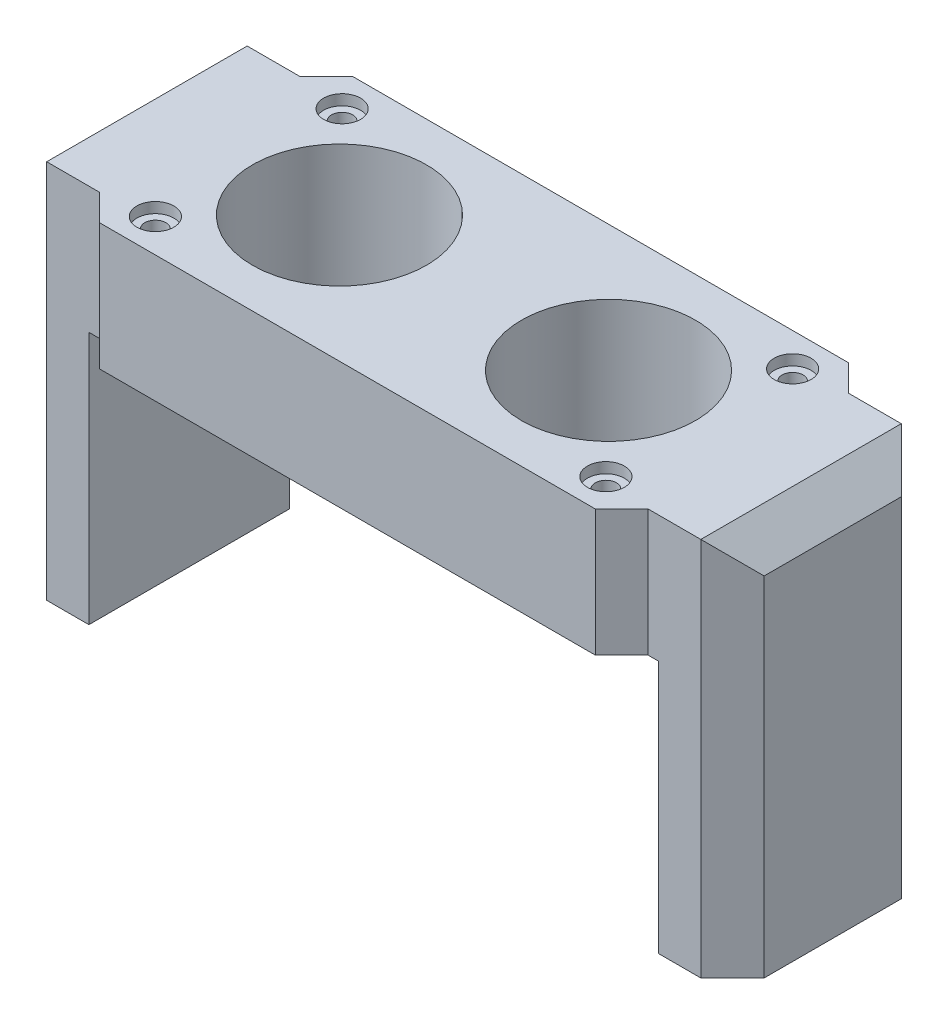
from build123d import *

# Parameters (mm, degrees)
SKETCH1_W                = 52
SKETCH1_H                = 24
SKETCH1_R                = 8.25
BOSS_EXTRUDE1_DEPTH      = 12
SKETCH2_R                = 1
CUT_EXTRUDE1_DEPTH       = 32.048349393
SKETCH3_R                = 1.75
CUT_EXTRUDE2_DEPTH       = 1
CUT_EXTRUDE3_DEPTH       = 5
FILLET3_R                = 0.5
CHAMFER1_SIZE            = 2.5
SKETCH5_W                = 19
SKETCH5_H                = 12
BOSS_EXTRUDE2_DEPTH      = 8
SKETCH6_W                = 7
SKETCH6_H                = 19
BOSS_EXTRUDE3_DEPTH      = 24
CHAMFER2_SIZE            = 3
CHAMFER2_OF_MIRROR1_SIZE = 3


with BuildPart() as part:
    # Sketch1 → Boss-Extrude1 (new body)
    with BuildSketch(Plane(origin=(0, 0, 0), x_dir=(1, 0, 0), z_dir=(0, 1, 0))):
        Rectangle(SKETCH1_W, SKETCH1_H)
        with Locations(Location((12.75, 0, 0), (0, 0, 270))):
            Circle(SKETCH1_R, mode=Mode.SUBTRACT)
        with Locations(Location((-12.75, 0, 0), (0, 0, 270))):
            Circle(SKETCH1_R, mode=Mode.SUBTRACT)
    extrude(amount=BOSS_EXTRUDE1_DEPTH)

    # Sketch2 → Cut-Extrude1 (cut, through all)
    with BuildSketch(Plane(origin=(0, 12, 0), x_dir=(1, 0, 0), z_dir=(0, 1, 0))):
        with Locations(Location((-21.35, 8.85, 0), (0, 0, 270))):
            Circle(SKETCH2_R)
        with Locations(Location((21.35, 8.85, 0), (0, 0, 270))):
            Circle(SKETCH2_R)
        with Locations(Location((21.35, -8.85, 0), (0, 0, 270))):
            Circle(SKETCH2_R)
        with Locations(Location((-21.35, -8.85, 0), (0, 0, 270))):
            Circle(SKETCH2_R)
    extrude(amount=-CUT_EXTRUDE1_DEPTH, mode=Mode.SUBTRACT)

    # Sketch3 → Cut-Extrude2 (cut)
    with BuildSketch(Plane(origin=(0, 12, 0), x_dir=(1, 0, 0), z_dir=(0, 1, 0))):
        with Locations(Location((-21.35, 8.85, 0), (0, 0, 270))):
            Circle(SKETCH3_R)
        with Locations(Location((21.35, 8.85, 0), (0, 0, 270))):
            Circle(SKETCH3_R)
        with Locations(Location((21.35, -8.85, 0), (0, 0, 270))):
            Circle(SKETCH3_R)
        with Locations(Location((-21.35, -8.85, 0), (0, 0, 270))):
            Circle(SKETCH3_R)
    extrude(amount=-CUT_EXTRUDE2_DEPTH, mode=Mode.SUBTRACT)

    # Sketch4 → Cut-Extrude3 (cut)
    with BuildSketch(Plane.XZ):
        Polygon((-6, -5), (-6, -12), (6, -12), (6, -5), (0, -5), align=None)
    extrude(amount=-CUT_EXTRUDE3_DEPTH, mode=Mode.SUBTRACT)

    # Fillet3
    fillet3_edges = [part.edges().sort_by_distance(p)[0] for p in [
        (-6, 2.5, -5),
        (6, 5, -8.5),
        (6, 2.5, -5),
        (-6, 5, -8.5),
        (0, 5, -5),
    ]]
    fillet(fillet3_edges, radius=FILLET3_R)

    # Chamfer1
    chamfer1_edges = [part.edges().sort_by_distance(p)[0] for p in [
        (26, 6, 12),
        (-26, 6, 12),
        (-26, 6, -12),
        (26, 6, -12),
    ]]
    chamfer(chamfer1_edges, length=CHAMFER1_SIZE)

    # Sketch5 → Boss-Extrude2 (add)
    with BuildSketch(Plane.ZY.offset(26)):
        with Locations((0, 6)):
            Rectangle(SKETCH5_W, SKETCH5_H)
    boss_extrude2 = extrude(amount=BOSS_EXTRUDE2_DEPTH)

    # Sketch6 → Boss-Extrude3 (add)
    with BuildSketch(Plane.XZ):
        with Locations((-30.5, 0)):
            Rectangle(SKETCH6_W, SKETCH6_H)
    boss_extrude3 = extrude(amount=BOSS_EXTRUDE3_DEPTH)

    # Chamfer2
    chamfer2_edges = [part.edges().sort_by_distance(p)[0] for p in [
        (-34, -6, 9.5),
        (-34, 12, 0),
        (-34, -6, -9.5),
    ]]
    chamfer(chamfer2_edges, length=CHAMFER2_SIZE)

    # Mirror1: Boss-Extrude2, Boss-Extrude3 across plane
    add(boss_extrude2.mirror(Plane(origin=(0, 0, 0), x_dir=(0, 0, 1), z_dir=(1, 0, 0))))
    add(boss_extrude3.mirror(Plane(origin=(0, 0, 0), x_dir=(0, 0, 1), z_dir=(1, 0, 0))))

    # Chamfer2 of Mirror1
    chamfer2_of_mirror1_edges = [part.edges().sort_by_distance(p)[0] for p in [
        (34, -6, 9.5),
        (34, 12, 0),
        (34, -6, -9.5),
    ]]
    chamfer(chamfer2_of_mirror1_edges, length=CHAMFER2_OF_MIRROR1_SIZE)


solid = part.part
